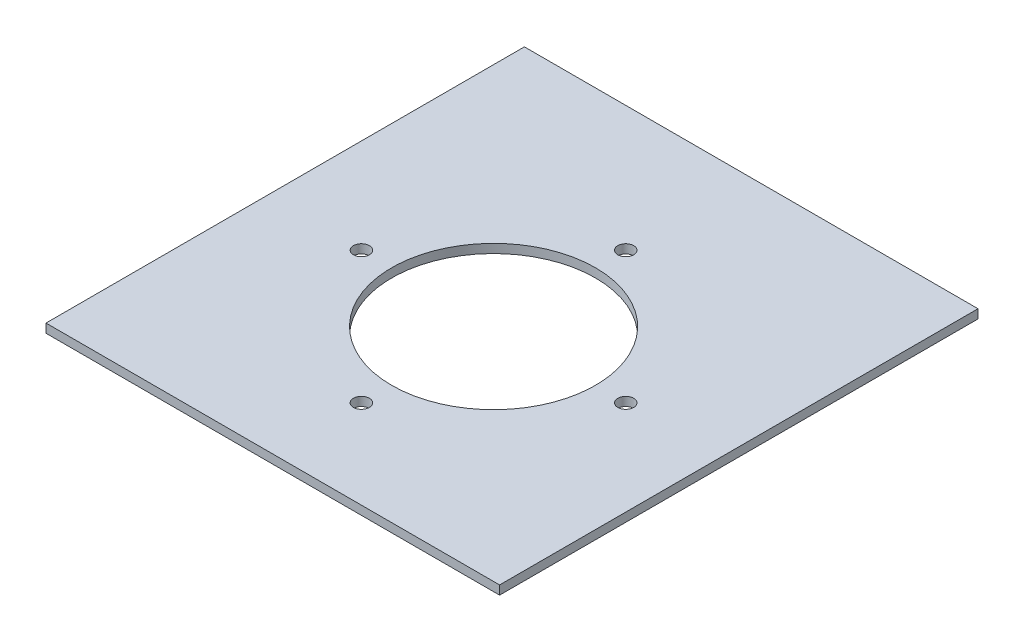
from build123d import *

# Parameters (mm, degrees)
SZKIC1_W                    = 256
SZKIC1_H                    = 270
DODANIE_WYCI_GNI_CIE1_DEPTH = 5
SZKIC2_R                    = 57.5
SZKIC2_R_2                  = 4.5
WYTNIJ_WYCI_GNI_CIE1_DEPTH  = 5


with BuildPart() as part:
    # Szkic1 → Dodanie-wyciągnięcie1 (new body)
    with BuildSketch(Plane(origin=(0, 0, 0), x_dir=(1, 0, 0), z_dir=(0, 1, 0))):
        with Locations((128, 135)):
            Rectangle(SZKIC1_W, SZKIC1_H)
    extrude(amount=DODANIE_WYCI_GNI_CIE1_DEPTH)

    # Szkic2 → Wytnij-wyciągnięcie1 (cut)
    with BuildSketch(Plane(origin=(0, 5, 0), x_dir=(1, 0, 0), z_dir=(0, 1, 0))):
        with Locations(Location((128, 124.6, 0), (0, 0, 270))):
            Circle(SZKIC2_R)
        with Locations(Location((128, 199.2, 0), (0, 0, 270))):
            Circle(SZKIC2_R_2)
        with Locations(Location((202.6, 124.6, 0), (0, 0, 270))):
            Circle(SZKIC2_R_2)
        with Locations(Location((128, 50, 0), (0, 0, 270))):
            Circle(SZKIC2_R_2)
        with Locations(Location((53.4, 124.6, 0), (0, 0, 270))):
            Circle(SZKIC2_R_2)
    extrude(amount=-WYTNIJ_WYCI_GNI_CIE1_DEPTH, mode=Mode.SUBTRACT)


solid = part.part
